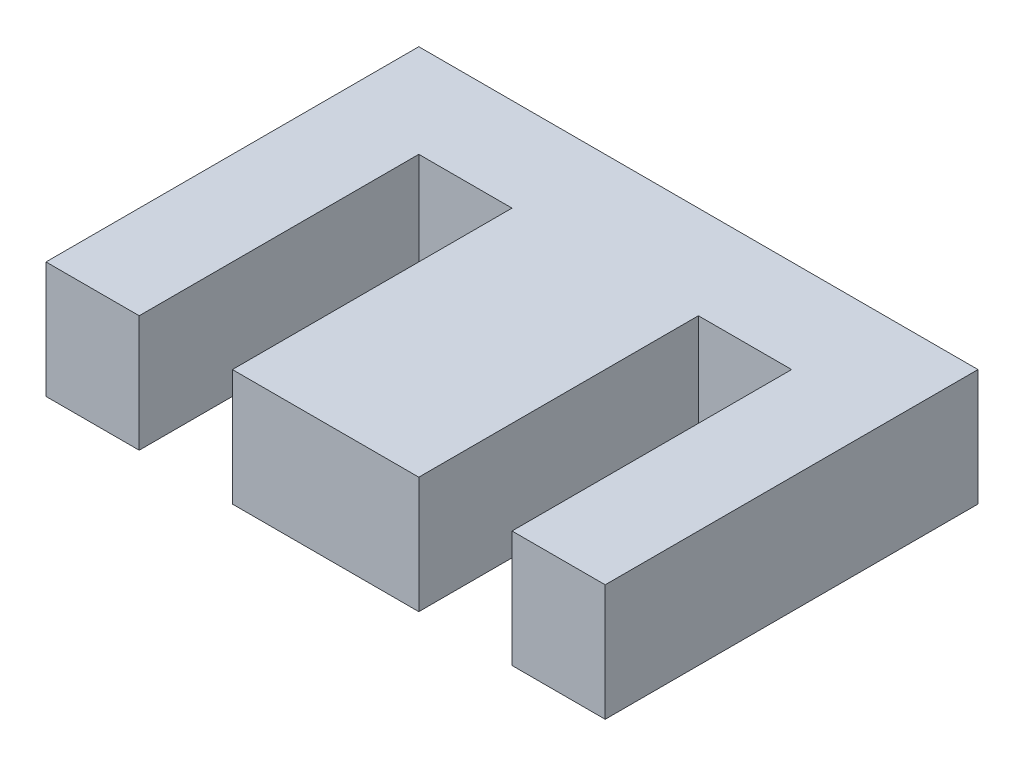
from build123d import *

# Parameters (mm, degrees)
BOSS_EXTRUDE1_DEPTH = 10


with BuildPart() as part:
    # Sketch1 → Boss-Extrude1 (new body)
    with BuildSketch(Plane(origin=(0, 0, 0), x_dir=(1, 0, 0), z_dir=(0, 1, 0))):
        Polygon((-24, -16), (-16, -16), (-16, 8), (-8, 8), (-8, -16), (8, -16), (8, 8), (16, 8), (16, -16), (24, -16), (24, 16), (-24, 16), align=None)
    extrude(amount=BOSS_EXTRUDE1_DEPTH)


solid = part.part
